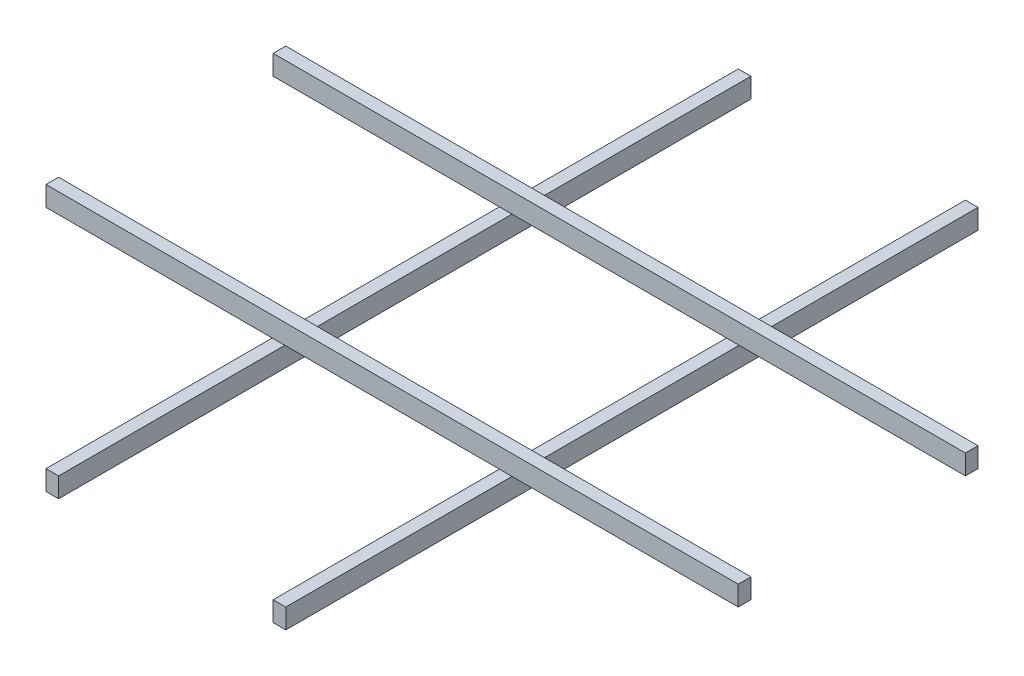
from build123d import *

# Parameters (mm, degrees)
SKETCH1_W              = 88.9
SKETCH1_H              = 139.7
PROFILES_4X6_1_DEPTH   = 4876.8
SKETCH1_ON_SEGMENT_2_W = 88.9
SKETCH1_ON_SEGMENT_2_H = 139.7
PROFILES_4X6_1_2_DEPTH = 4876.8
SKETCH1_ON_SEGMENT_3_W = 88.9
SKETCH1_ON_SEGMENT_3_H = 139.7
PROFILES_4X6_1_3_DEPTH = 4876.8
SKETCH1_ON_SEGMENT_4_W = 88.9
SKETCH1_ON_SEGMENT_4_H = 139.7
PROFILES_4X6_1_4_DEPTH = 4876.8


with BuildPart() as part:
    # Sketch1 → Profiles 4X6(1) (new body)
    with BuildSketch(Plane(origin=(1333.5, 0, 0), x_dir=(-1, 0, 0), z_dir=(0, 0, -1))):
        Rectangle(SKETCH1_W, SKETCH1_H)
    extrude(amount=PROFILES_4X6_1_DEPTH)


with BuildPart() as body_2:
    # Sketch1 on segment 2 (carried to segment 2) → Profiles 4X6_1 2 (new body)
    with BuildSketch(Plane(origin=(2933.7, 0, 0), x_dir=(-1, 0, 0), z_dir=(0, 0, -1))):
        Rectangle(SKETCH1_ON_SEGMENT_2_W, SKETCH1_ON_SEGMENT_2_H)
    extrude(amount=PROFILES_4X6_1_2_DEPTH)


with BuildPart() as body_3:
    # Sketch1 on segment 3 (carried to segment 3) → Profiles 4X6_1 3 (new body)
    with BuildSketch(Plane(origin=(-304.8, 139.7, -3238.5), x_dir=(0, 0, -1), z_dir=(1, 0, 0))):
        Rectangle(SKETCH1_ON_SEGMENT_3_W, SKETCH1_ON_SEGMENT_3_H)
    extrude(amount=PROFILES_4X6_1_3_DEPTH)


with BuildPart() as body_4:
    # Sketch1 on segment 4 (carried to segment 4) → Profiles 4X6_1 4 (new body)
    with BuildSketch(Plane(origin=(4572, 139.7, -1638.3), x_dir=(0, 0, 1), z_dir=(-1, 0, 0))):
        Rectangle(SKETCH1_ON_SEGMENT_4_W, SKETCH1_ON_SEGMENT_4_H)
    extrude(amount=PROFILES_4X6_1_4_DEPTH)


solid = Compound([part.part, body_2.part, body_3.part, body_4.part])
